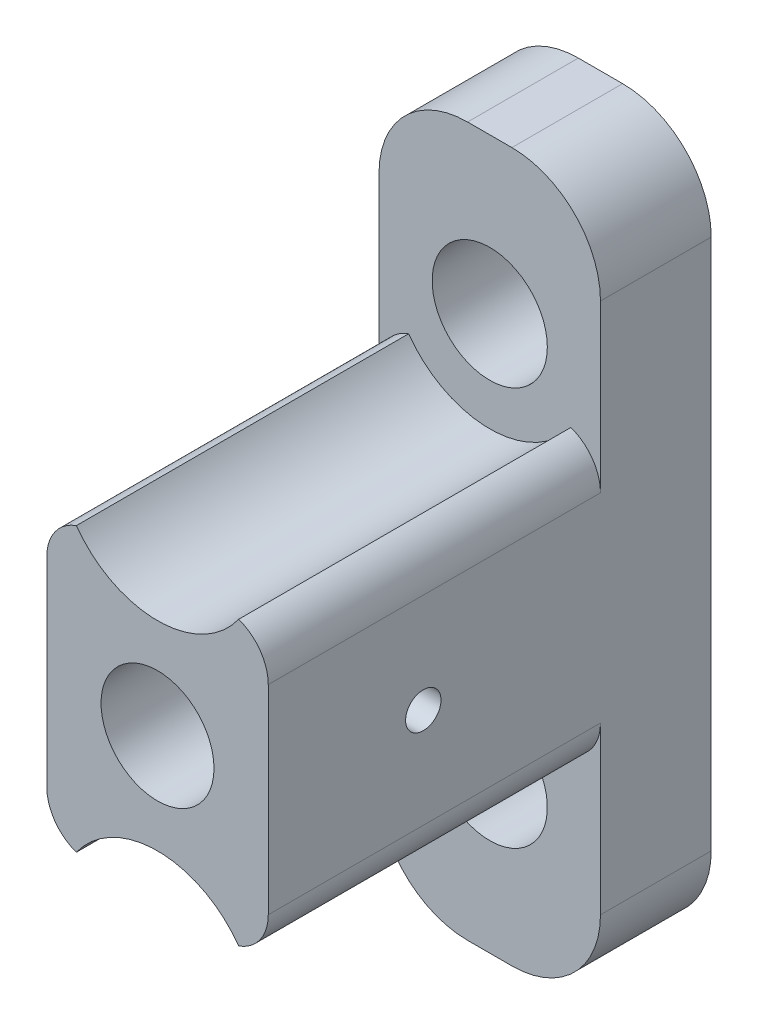
from build123d import *

# Parameters (mm, degrees)
SKETCH1_R               = 2.6
BOSS_EXTRUDE1_DEPTH     = 5
SKETCH2_W               = 10
SKETCH2_H               = 13
SKETCH2_R               = 2.55
BOSS_EXTRUDE3_DEPTH     = 15
FILLET2_R               = 2
SKETCH6_R               = 4.5
CUT_EXTRUDE2_DEPTH      = 15
CUT_EXTRUDE3_DEPTH      = 25.103941586
CUT_EXTRUDE3_DEPTH_BACK = 25.103941586
SKETCH7_R               = 0.8


with BuildPart() as part:
    # Sketch1 → Boss-Extrude1 (new body)
    with BuildSketch(Plane.XY):
        with BuildLine():
            Line((-5, -12), (-5, 12))
            ThreePointArc((-5, 12), (-3.828427125, 14.828427125), (-1, 16))
            Line((-1, 16), (1, 16))
            ThreePointArc((1, 16), (3.828427125, 14.828427125), (5, 12))
            Line((5, 12), (5, -12))
            ThreePointArc((5, -12), (3.828427125, -14.828427125), (1, -16))
            Line((1, -16), (-1, -16))
            ThreePointArc((-1, -16), (-3.828427125, -14.828427125), (-5, -12))
        make_face()
        with Locations((0, 9)):
            Circle(SKETCH1_R, mode=Mode.SUBTRACT)
        with Locations(Location((0, -9, 0), (0, 0, 180))):
            Circle(SKETCH1_R, mode=Mode.SUBTRACT)
    extrude(amount=-BOSS_EXTRUDE1_DEPTH)

    # Sketch2 → Boss-Extrude3 (add)
    with BuildSketch(Plane.XY):
        Rectangle(SKETCH2_W, SKETCH2_H)
        Circle(SKETCH2_R, mode=Mode.SUBTRACT)
    extrude(amount=BOSS_EXTRUDE3_DEPTH)

    # Fillet2
    fillet2_edges = [part.edges().sort_by_distance(p)[0] for p in [
        (5, -6.5, 7.5),
        (5, 6.5, 7.5),
        (-5, 6.5, 7.5),
        (-5, -6.5, 7.5),
    ]]
    fillet(fillet2_edges, radius=FILLET2_R)

    # Sketch6 → Cut-Extrude2 (cut)
    with BuildSketch(Plane.XY.offset(15)):
        with Locations((0, 9)):
            Circle(SKETCH6_R)
        with Locations((0, -9)):
            Circle(SKETCH6_R)
    extrude(amount=-CUT_EXTRUDE2_DEPTH, mode=Mode.SUBTRACT)

    # Sketch7 → Cut-Extrude3 (cut, two sides: drawn at the far end of the back side and taken through both)
    with BuildSketch(Plane(origin=(5, 0, 0), x_dir=(0, 0, -1), z_dir=(1, 0, 0)).offset(-CUT_EXTRUDE3_DEPTH_BACK)):
        with Locations((-8, 0)):
            Circle(SKETCH7_R)
    extrude(amount=CUT_EXTRUDE3_DEPTH + CUT_EXTRUDE3_DEPTH_BACK, mode=Mode.SUBTRACT)


solid = part.part
